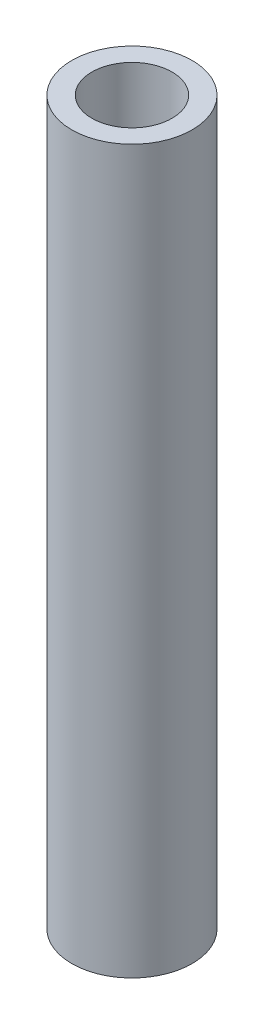
from build123d import *

# Parameters (mm, degrees)
SKETCH1_R           = 4.5
SKETCH1_R_2         = 3
BOSS_EXTRUDE1_DEPTH = 54


with BuildPart() as part:
    # Sketch1 → Boss-Extrude1 (new body)
    with BuildSketch(Plane(origin=(0, 0, 0), x_dir=(1, 0, 0), z_dir=(0, 1, 0))):
        with Locations(Location((0, 0, 0), (0, 0, 270))):
            Circle(SKETCH1_R)
        with Locations(Location((0, 0, 0), (0, 0, 270))):
            Circle(SKETCH1_R_2, mode=Mode.SUBTRACT)
    extrude(amount=BOSS_EXTRUDE1_DEPTH)


solid = part.part
